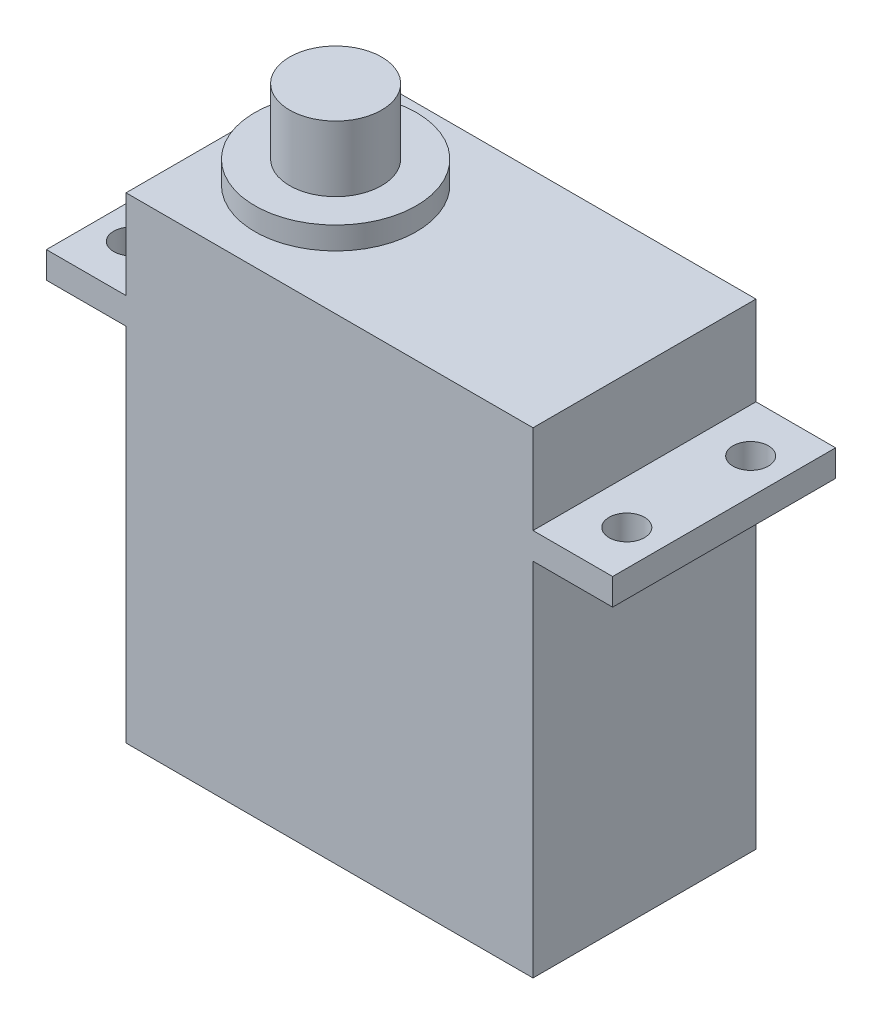
from build123d import *

# Parameters (mm, degrees)
SKETCH_1_W          = 23
SKETCH_1_H          = 5.03
SKETCH_1_W_2        = 4.5
SKETCH_1_H_2        = 1.5
SKETCH_1_H_3        = 20.4
EXTRUDE_1_DEPTH     = 6.3
SKETCH_3_R          = 1
CUT_EXTRUDE_1_DEPTH = 10


with BuildPart() as part:
    # 草图1 → 凸台-拉伸1 (new, symmetric)
    with BuildSketch(Plane.XY):
        with Locations((0, 10.95)):
            Rectangle(SKETCH_1_W, SKETCH_1_H)
        with Locations((13.75, 7.685)):
            Rectangle(SKETCH_1_W_2, SKETCH_1_H_2)
        with Locations((0, -3.265)):
            Rectangle(SKETCH_1_W, SKETCH_1_H_3)
        with Locations((-13.75, 7.685)):
            Rectangle(SKETCH_1_W_2, SKETCH_1_H_2)
        with Locations((0, 7.685)):
            Rectangle(SKETCH_1_W, SKETCH_1_H_2)
    extrude(amount=EXTRUDE_1_DEPTH, both=True)

    # 草图2 → 旋转1 (revolve)
    with BuildSketch(Plane.XY, mode=Mode.PRIVATE) as revolve_1_sk:
        Polygon((-5.955, 13.465), (-10.52, 13.465), (-10.52, 14.735), (-8.555, 14.735), (-8.555, 18.435), (-5.955, 18.435), align=None)
    revolve(revolve_1_sk.sketch.rotate(Axis((-5.955, 10.839744531, 0), (0, 1, 0)), 270), axis=Axis((-5.955, 10.839744531, 0), (0, 1, 0)))

    # 草图3 → 切除-拉伸1 (cut)
    with BuildSketch(Plane(origin=(0, 8.435, 0), x_dir=(1, 0, 0), z_dir=(0, 1, 0))):
        with Locations(Location((-14, 3.5, 0), (0, 0, 180))):
            Circle(SKETCH_3_R)
        with Locations(Location((14, 3.5, 0), (0, 0, 180))):
            Circle(SKETCH_3_R)
        with Locations(Location((14, -3.5, 0), (0, 0, 270))):
            Circle(SKETCH_3_R)
        with Locations(Location((-14, -3.5, 0), (0, 0, 270))):
            Circle(SKETCH_3_R)
    extrude(amount=-CUT_EXTRUDE_1_DEPTH, mode=Mode.SUBTRACT)


solid = part.part
